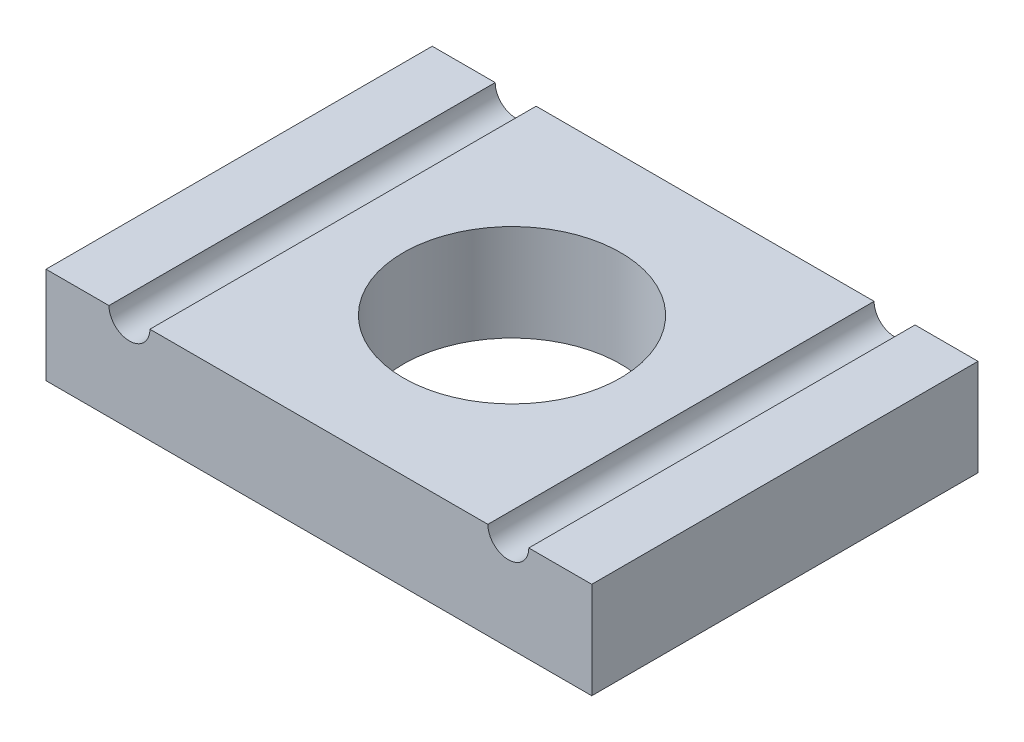
from build123d import *

# Parameters (mm, degrees)
SKETCH1_W           = 35.8902
SKETCH1_H           = 25.4
SKETCH1_R           = 7.14375
BOSS_EXTRUDE1_DEPTH = 6.35
SKETCH2_R           = 1.3462
CUT_EXTRUDE1_DEPTH  = 32.741284064


with BuildPart() as part:
    # Sketch1 → Boss-Extrude1 (new body)
    with BuildSketch(Plane(origin=(0, 0, 0), x_dir=(1, 0, 0), z_dir=(0, 1, 0))):
        Rectangle(SKETCH1_W, SKETCH1_H)
        with Locations(Location((0, 0, 0), (0, 0, 270))):
            Circle(SKETCH1_R, mode=Mode.SUBTRACT)
    extrude(amount=BOSS_EXTRUDE1_DEPTH)

    # Sketch2 → Cut-Extrude1 (cut, through all)
    with BuildSketch(Plane.XY.offset(12.7)):
        with Locations((-12.4587, 6.35)):
            Circle(SKETCH2_R)
        with Locations((12.4587, 6.35)):
            Circle(SKETCH2_R)
    extrude(amount=-CUT_EXTRUDE1_DEPTH, mode=Mode.SUBTRACT)


solid = part.part
